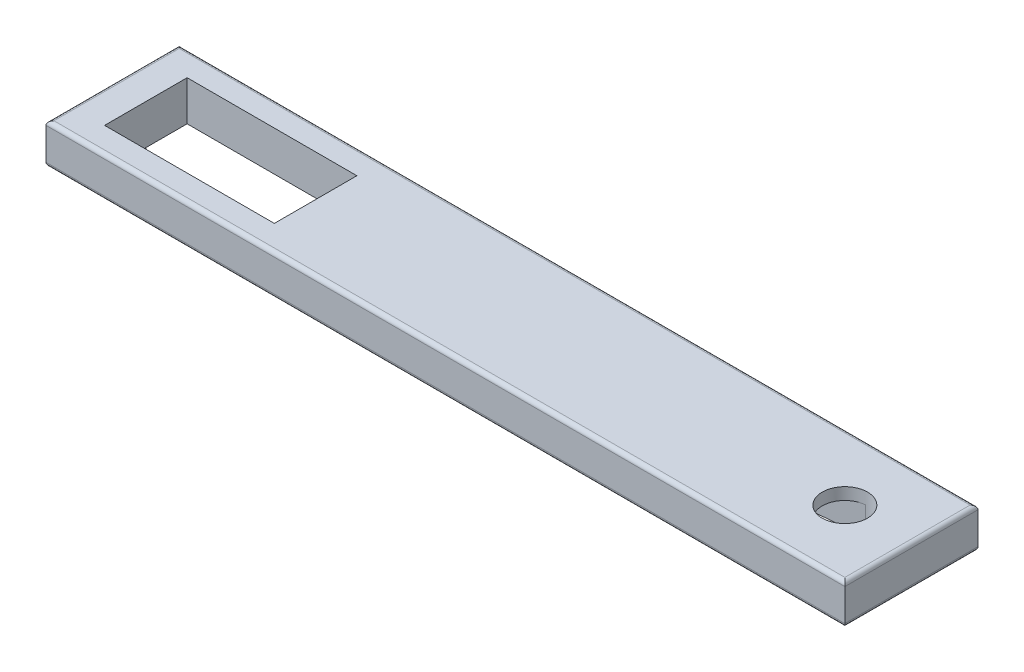
from build123d import *

# Parameters (mm, degrees)
SKETCH1_W           = 120
SKETCH1_H           = 20
SKETCH1_W_2         = 25.5
SKETCH1_H_2         = 12.4
BOSS_EXTRUDE1_DEPTH = 6
SKETCH3_R           = 0.55
BOSS_EXTRUDE2_DEPTH = 3
SKETCH4_W           = 36
SKETCH4_H           = 20
BOSS_EXTRUDE3_DEPTH = 1.8
SKETCH5_R           = 3.4
CUT_EXTRUDE1_DEPTH  = 1.8
FILLET1_R           = 0.6


with BuildPart() as part:
    # Sketch1 → Boss-Extrude1 (new body)
    with BuildSketch(Plane(origin=(0, 0, 0), x_dir=(1, 0, 0), z_dir=(0, 1, 0))):
        with Locations((60, 10)):
            Rectangle(SKETCH1_W, SKETCH1_H)
        with BuildLine():
            Line((93.674922601, 11.942124585), (109.694736842, 13.386268507))
            ThreePointArc((109.694736842, 13.386268507), (113.4, 10), (109.694736842, 6.613731493))
            Line((109.694736842, 6.613731493), (93.674922601, 8.057875415))
            ThreePointArc((93.674922601, 8.057875415), (91.9, 10), (93.674922601, 11.942124585))
        make_face(mode=Mode.SUBTRACT)
        with Locations((17.75, 10)):
            Rectangle(SKETCH1_W_2, SKETCH1_H_2, mode=Mode.SUBTRACT)
    extrude(amount=BOSS_EXTRUDE1_DEPTH)

    # Sketch3 → Boss-Extrude2 (add)
    with BuildSketch(Plane.XZ):
        with Locations(Location((4.25, -10, 0), (0, 0, 270))):
            Circle(SKETCH3_R)
        with Locations(Location((31.25, -10, 0), (0, 0, 270))):
            Circle(SKETCH3_R)
    extrude(amount=BOSS_EXTRUDE2_DEPTH)

    # Sketch4 → Boss-Extrude3 (add)
    with BuildSketch(Plane(origin=(0, 6, 0), x_dir=(1, 0, 0), z_dir=(0, 1, 0))):
        with Locations((102, 10)):
            Rectangle(SKETCH4_W, SKETCH4_H)
    extrude(amount=-BOSS_EXTRUDE3_DEPTH)

    # Sketch5 → Cut-Extrude1 (cut)
    with BuildSketch(Plane.XZ.offset(-4.2)):
        with Locations(Location((110, -10, 0), (0, 0, 270))):
            Circle(SKETCH5_R)
    extrude(amount=-CUT_EXTRUDE1_DEPTH, mode=Mode.SUBTRACT)

    # Fillet1
    fillet1_edges = [part.edges().sort_by_distance(p)[0] for p in [
        (120, 6, -10),
        (60, 6, -20),
        (0, 6, -10),
        (60, 0, -20),
        (120, 0, -10),
        (60, 0, 0),
        (0, 0, -10),
        (60, 6, 0),
    ]]
    fillet(fillet1_edges, radius=FILLET1_R)


solid = part.part
